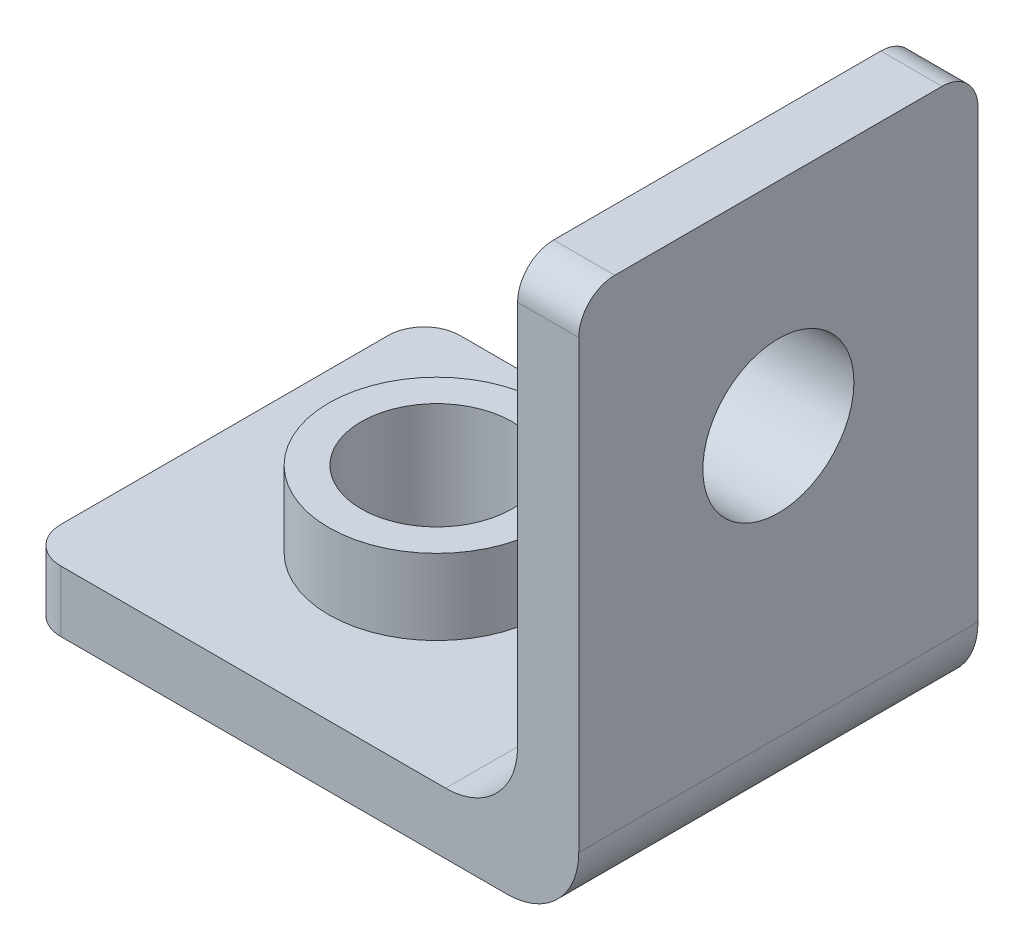
from build123d import *

# Parameters (mm, degrees)
EXTRUDE_1_DEPTH    = 11.1
FILLET_1_R         = 1
SKETCH_3_R         = 3
EXTRUDE_2_DEPTH    = 3.8
SKETCH_2_R         = 3
EXTRUDE_3_DEPTH    = 3.8
FILLET_2_R         = 2
HOLE_WIZARD_M5_3_D = 4.2
HOLE_WIZARD_M5_4_D = 4.2


with BuildPart() as part:
    # 草图1 → 凸台-拉伸1 (new body)
    with BuildSketch(Plane.XY):
        Polygon((0, 0), (0, 15.4), (-1.7, 15.4), (-1.7, 1.7), (-15.4, 1.7), (-15.4, 0), align=None)
    extrude(amount=EXTRUDE_1_DEPTH)

    # 圆角1
    fillet_1_edges = [part.edges().sort_by_distance(p)[0] for p in [
        (-0.85, 15.4, 11.1),
        (-15.4, 0.85, 11.1),
        (-15.4, 0.85, 0),
        (-0.85, 15.4, 0),
    ]]
    fillet(fillet_1_edges, radius=FILLET_1_R)

    # 草图3 → 凸台-拉伸2 (add)
    with BuildSketch(Plane(origin=(0, 0, 0), x_dir=(1, 0, 0), z_dir=(0, 1, 0))):
        with Locations(Location((-9.5, -5.55, 0), (0, 0, 90))):
            Circle(SKETCH_3_R)
    extrude(amount=EXTRUDE_2_DEPTH)

    # 草图2 → 凸台-拉伸3 (add)
    with BuildSketch(Plane(origin=(0, 0, 0), x_dir=(0, 0, -1), z_dir=(1, 0, 0))):
        with Locations((-5.55, 9.5)):
            Circle(SKETCH_2_R)
    extrude(amount=-EXTRUDE_3_DEPTH)

    # 圆角2
    fillet_2_edges = [part.edges().sort_by_distance(p)[0] for p in [
        (-1.7, 1.7, 5.55),
        (0, 0, 5.55),
    ]]
    fillet(fillet_2_edges, radius=FILLET_2_R)

    # M5 螺纹孔3 (through all)
    with Locations(Plane(origin=(0, 0, 0), x_dir=(0, 0, -1), z_dir=(1, 0, 0))):
        with Locations((-5.55, 9.5)):
            Hole(HOLE_WIZARD_M5_3_D / 2)

    # M5 螺纹孔4 (through all)
    with Locations(Plane(origin=(0, 0, 0), x_dir=(-1, 0, 0), z_dir=(0, -1, 0))):
        with Locations((9.5, -5.55)):
            Hole(HOLE_WIZARD_M5_4_D / 2)


solid = part.part
